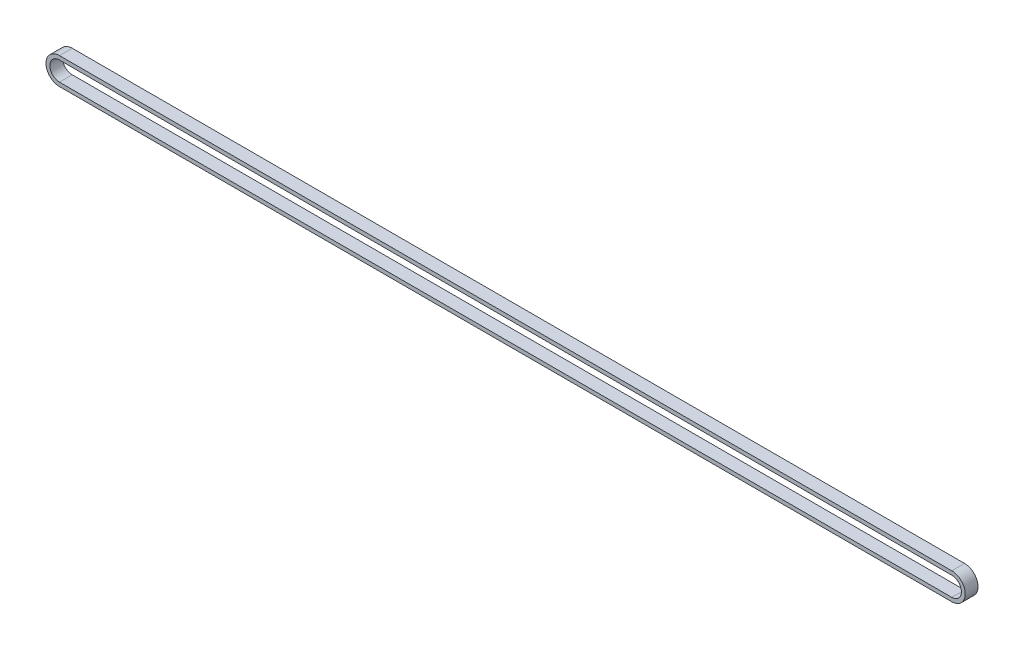
from build123d import *

# Parameters (mm, degrees)
EXTRUDE_THIN1_DEPTH = 6


with BuildPart() as part:
    # Sketch1 → Extrude-Thin1 (new body)
    with BuildSketch(Plane.XY):
        with BuildLine():
            Line((209.565, -6.3), (-209.565, -6.3))
            ThreePointArc((-209.565, -6.3), (-215.865, 0), (-209.565, 6.3))
            Line((-209.565, 6.3), (209.565, 6.3))
            ThreePointArc((209.565, 6.3), (215.865, 0), (209.565, -6.3))
        make_face()
        with BuildLine():
            Line((209.565, -4.5), (-209.565, -4.5))
            ThreePointArc((-209.565, -4.5), (-214.065, 0), (-209.565, 4.5))
            Line((-209.565, 4.5), (209.565, 4.5))
            ThreePointArc((209.565, 4.5), (214.065, 0), (209.565, -4.5))
        make_face(mode=Mode.SUBTRACT)
    extrude(amount=EXTRUDE_THIN1_DEPTH)


solid = part.part
